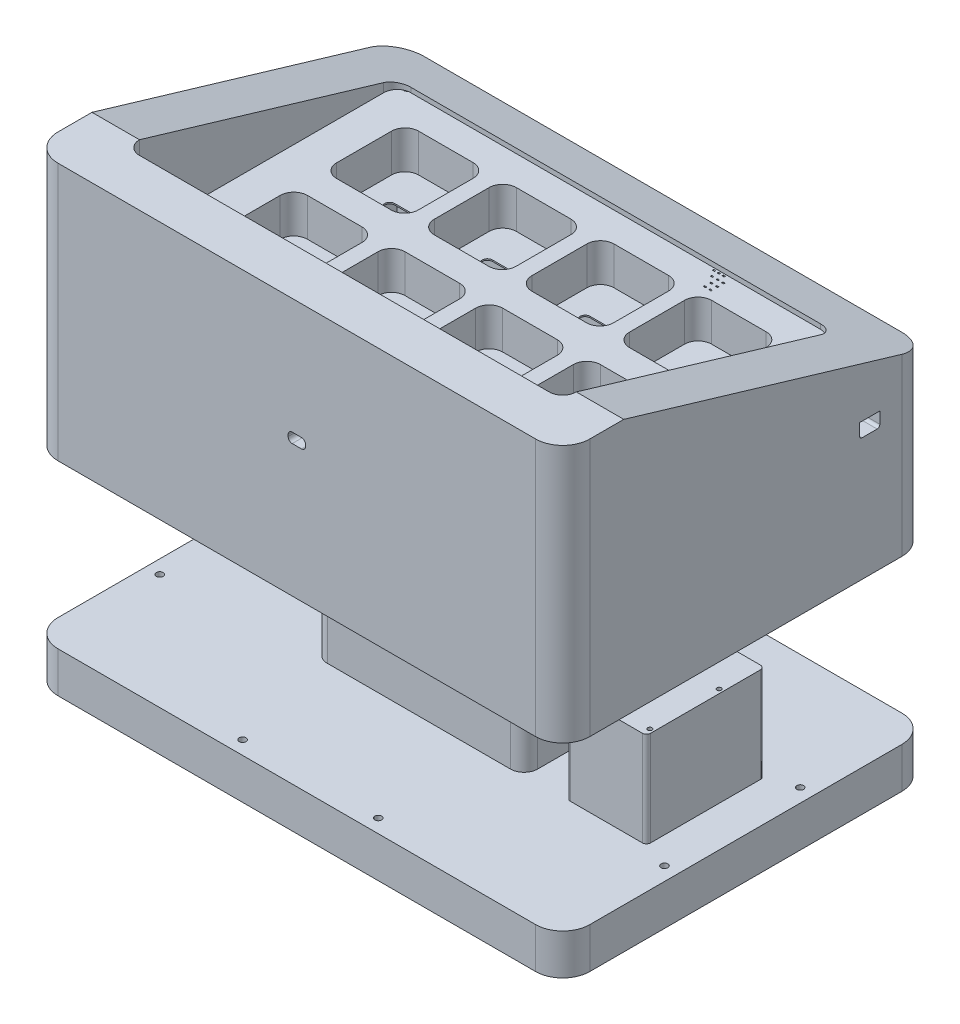
from build123d import *

# Parameters (mm, degrees)
BOSS_EXTRUDE1_DEPTH      = 30
SKETCH3_W                = 155
SKETCH3_H                = 90
BOSS_EXTRUDE2_DEPTH      = 70
SKETCH17_W               = 392
SKETCH17_H               = 270
BOSS_EXTRUDE3_DEPTH      = 190
FILLET4_R                = 20
FILLET5_R                = 10
CUT_EXTRUDE1_DEPTH       = 60
CUT_EXTRUDE2_DEPTH       = 28
CUT_EXTRUDE11_DEPTH      = 31
SKETCH101_W              = 352
SKETCH101_H              = 230
CUT_EXTRUDE12_DEPTH      = 101
SKETCH107_R              = 2.5
CUT_EXTRUDE14_DEPTH      = 30
FILLET6_R                = 20
SKETCH144_W              = 3.05
SKETCH144_H              = 6.1
CUT_EXTRUDE25_DEPTH      = 20
CUT_EXTRUDE27_DEPTH      = 370
CUT_EXTRUDE27_DEPTH_BACK = 35
BOSS_EXTRUDE12_START     = -30
BOSS_EXTRUDE12_DEPTH     = 30
CUT_EXTRUDE29_DEPTH      = 70
SKETCH173_W              = 15
SKETCH173_H              = 10
BOSS_EXTRUDE13_DEPTH     = 20
SKETCH174_W              = 15
SKETCH174_H              = 15
CUT_EXTRUDE37_DEPTH      = 20
FILLET8_R                = 2
BOSS_EXTRUDE24_DEPTH     = 20
SKETCH209_W              = 1.6
SKETCH209_H              = 1
CUT_EXTRUDE42_DEPTH      = 30
CUT_EXTRUDE43_DEPTH      = 20
CUT_EXTRUDE44_DEPTH      = 19.5
SKETCH229_R              = 2.25
CUT_EXTRUDE46_DEPTH      = 20
SKETCH230_R              = 1.6
BOSS_EXTRUDE27_DEPTH     = 70
SKETCH231_R              = 2.25
CUT_EXTRUDE47_DEPTH      = 20
SKETCH232_R              = 2.5
CUT_EXTRUDE48_DEPTH      = 30


with BuildPart() as part:
    # Sketch2 → Boss-Extrude1 (new body)
    with BuildSketch(Plane(origin=(0, 0, 0), x_dir=(1, 0, 0), z_dir=(0, 1, 0))):
        Polygon((-196, 135), (-196, -135), (-61, -135), (196, -135), (196, 135), align=None)
    extrude(amount=BOSS_EXTRUDE1_DEPTH)

    # Sketch3 → Boss-Extrude2 (add)
    with BuildSketch(Plane(origin=(0, 30, 0), x_dir=(1, 0, 0), z_dir=(0, 1, 0))):
        Rectangle(SKETCH3_W, SKETCH3_H)
    extrude(amount=BOSS_EXTRUDE2_DEPTH)

    # Fillet5
    fillet5_edges = [part.edges().sort_by_distance(p)[0] for p in [
        (77.5, 65, -45),
        (-77.5, 65, -45),
        (-77.5, 65, 45),
        (77.5, 65, 45),
    ]]
    fillet(fillet5_edges, radius=FILLET5_R)

    # Fillet6
    fillet6_edges = [part.edges().sort_by_distance(p)[0] for p in [
        (196, 15, 135),
        (-196, 15, 135),
        (-196, 15, -135),
        (196, 15, -135),
    ]]
    fillet(fillet6_edges, radius=FILLET6_R)

    # Sketch150 → Boss-Extrude12 (add)
    with BuildSketch(Plane.XZ.offset(BOSS_EXTRUDE12_START)):
        with BuildLine():
            Line((176, 135), (-176, 135))
            ThreePointArc((-176, 135), (-190.142135624, 129.142135624), (-196, 115))
            Line((-196, 115), (-196, -115))
            ThreePointArc((-196, -115), (-190.142135624, -129.142135624), (-176, -135))
            Line((-176, -135), (176, -135))
            ThreePointArc((176, -135), (190.142135624, -129.142135624), (196, -115))
            Line((196, -115), (196, 115))
            ThreePointArc((196, 115), (190.142135624, 129.142135624), (176, 135))
        make_face()
    extrude(amount=BOSS_EXTRUDE12_DEPTH)

    # Sketch151 → Cut-Extrude29 (cut)
    with BuildSketch(Plane(origin=(0, 100, 0), x_dir=(1, 0, 0), z_dir=(0, 1, 0))):
        with BuildLine():
            Line((-67.5, -38), (67.5, -38))
            ThreePointArc((67.5, -38), (69.621320344, -37.121320344), (70.5, -35))
            Line((70.5, -35), (70.5, 35))
            ThreePointArc((70.5, 35), (69.621320344, 37.121320344), (67.5, 38))
            Line((67.5, 38), (-67.5, 38))
            ThreePointArc((-67.5, 38), (-69.621320344, 37.121320344), (-70.5, 35))
            Line((-70.5, 35), (-70.5, -35))
            ThreePointArc((-70.5, -35), (-69.621320344, -37.121320344), (-67.5, -38))
        make_face()
    extrude(amount=-CUT_EXTRUDE29_DEPTH, mode=Mode.SUBTRACT)

    # Sketch230 → Boss-Extrude27 (add)
    with BuildSketch(Plane(origin=(0, 30, 0), x_dir=(1, 0, 0), z_dir=(0, 1, 0))):
        with BuildLine():
            Line((110.25, 43.5), (163.25, 43.5))
            ThreePointArc((163.25, 43.5), (165.371320344, 42.621320344), (166.25, 40.5))
            Line((166.25, 40.5), (166.25, -40.5))
            ThreePointArc((166.25, -40.5), (165.371320344, -42.621320344), (163.25, -43.5))
            Line((163.25, -43.5), (110.25, -43.5))
            ThreePointArc((110.25, -43.5), (108.128679656, -42.621320344), (107.25, -40.5))
            Line((107.25, -40.5), (107.25, 40.5))
            ThreePointArc((107.25, 40.5), (108.128679656, 42.621320344), (110.25, 43.5))
        make_face()
        with Locations(Location((163.25, -38, 0), (0, 0, 270))):
            Circle(SKETCH230_R, mode=Mode.SUBTRACT)
        with Locations(Location((163.25, 13, 0), (0, 0, 90))):
            Circle(SKETCH230_R, mode=Mode.SUBTRACT)
        with Locations(Location((116.25, -38, 0), (0, 0, 90))):
            Circle(SKETCH230_R, mode=Mode.SUBTRACT)
        with Locations(Location((116.25, 13, 0), (0, 0, 270))):
            Circle(SKETCH230_R, mode=Mode.SUBTRACT)
    extrude(amount=BOSS_EXTRUDE27_DEPTH)

    # Sketch232 → Cut-Extrude48 (cut)
    with BuildSketch(Plane(origin=(0, 30, 0), x_dir=(1, 0, 0), z_dir=(0, 1, 0))):
        with Locations(Location((-50, 125, 0), (0, 0, 270))):
            Circle(SKETCH232_R)
        with Locations(Location((50, 125, 0), (0, 0, 90))):
            Circle(SKETCH232_R)
        with Locations(Location((-186, 50, 0), (0, 0, 270))):
            Circle(SKETCH232_R)
        with Locations(Location((-186, -50, 0), (0, 0, 90))):
            Circle(SKETCH232_R)
    cut_extrude48 = extrude(amount=-CUT_EXTRUDE48_DEPTH, mode=Mode.SUBTRACT)

    # Mirror11: Cut-Extrude48 across plane
    add(cut_extrude48.mirror(Plane.XY), mode=Mode.SUBTRACT)

    # Mirror11 at the second plane: Cut-Extrude48 across plane
    add(cut_extrude48.mirror(Plane(origin=(0, 0, 0), x_dir=(0, 0, 1), z_dir=(1, 0, 0))), mode=Mode.SUBTRACT)


with BuildPart() as body_2:
    # Sketch17 → Boss-Extrude3 (new body)
    with BuildSketch(Plane(origin=(0, 150, 0), x_dir=(1, 0, 0), z_dir=(0, 1, 0))):
        Rectangle(SKETCH17_W, SKETCH17_H)
    extrude(amount=BOSS_EXTRUDE3_DEPTH)

    # Fillet4
    fillet4_edges = [body_2.edges().sort_by_distance(p)[0] for p in [
        (196, 245, 135),
        (-196, 245, 135),
        (-196, 245, -135),
        (196, 245, -135),
    ]]
    fillet(fillet4_edges, radius=FILLET4_R)

    # Sketch71 → Cut-Extrude1 (cut)
    with BuildSketch(Plane(origin=(0, 340, 0), x_dir=(1, 0, 0), z_dir=(0, 1, 0))):
        with BuildLine():
            Line((-161, 90), (-161, -90))
            ThreePointArc((-161, -90), (-158.071067812, -97.071067812), (-151, -100))
            Line((-151, -100), (151, -100))
            ThreePointArc((151, -100), (158.071067812, -97.071067812), (161, -90))
            Line((161, -90), (161, 90))
            ThreePointArc((161, 90), (158.071067812, 97.071067812), (151, 100))
            Line((151, 100), (-151, 100))
            ThreePointArc((-151, 100), (-158.071067812, 97.071067812), (-161, 90))
        make_face()
    extrude(amount=-CUT_EXTRUDE1_DEPTH, mode=Mode.SUBTRACT)

    # Sketch75 → Cut-Extrude2 (cut)
    with BuildSketch(Plane(origin=(0, 280, 0), x_dir=(1, 0, 0), z_dir=(0, 1, 0))):
        with BuildLine():
            Line((-73.4, -33.357), (-73.4, -13.627))
            ThreePointArc((-73.4, -13.627), (-76.328932188, -6.555932188), (-83.4, -3.627))
            Line((-83.4, -3.627), (-107, -3.627))
            Line((-107, -3.627), (-123.6, -3.627))
            ThreePointArc((-123.6, -3.627), (-130.671067812, -6.555932188), (-133.6, -13.627))
            Line((-133.6, -13.627), (-133.6, -33.357))
            Line((-133.6, -33.357), (-133.6, -54.087))
            ThreePointArc((-133.6, -54.087), (-130.671067812, -61.158067812), (-123.6, -64.087))
            Line((-123.6, -64.087), (-107, -64.087))
            Line((-107, -64.087), (-83.4, -64.087))
            ThreePointArc((-83.4, -64.087), (-76.328932188, -61.158067812), (-73.4, -54.087))
            Line((-73.4, -54.087), (-73.4, -33.357))
        make_face()
        with BuildLine():
            Line((-1.4, -54.087), (-1.4, -33.357))
            Line((-1.4, -33.357), (-1.4, -13.627))
            ThreePointArc((-1.4, -13.627), (-4.328932188, -6.555932188), (-11.4, -3.627))
            Line((-11.4, -3.627), (-35, -3.627))
            Line((-35, -3.627), (-51.6, -3.627))
            ThreePointArc((-51.6, -3.627), (-58.671067812, -6.555932188), (-61.6, -13.627))
            Line((-61.6, -13.627), (-61.6, -33.357))
            Line((-61.6, -33.357), (-61.6, -54.087))
            ThreePointArc((-61.6, -54.087), (-58.671067812, -61.158067812), (-51.6, -64.087))
            Line((-51.6, -64.087), (-35, -64.087))
            Line((-35, -64.087), (-11.4, -64.087))
            ThreePointArc((-11.4, -64.087), (-4.328932188, -61.158067812), (-1.4, -54.087))
        make_face()
        with BuildLine():
            Line((70.6, -54.087), (70.6, -33.357))
            Line((70.6, -33.357), (70.6, -13.627))
            ThreePointArc((70.6, -13.627), (67.671067812, -6.555932188), (60.6, -3.627))
            Line((60.6, -3.627), (37, -3.627))
            Line((37, -3.627), (20.4, -3.627))
            ThreePointArc((20.4, -3.627), (13.328932188, -6.555932188), (10.4, -13.627))
            Line((10.4, -13.627), (10.4, -33.357))
            Line((10.4, -33.357), (10.4, -54.087))
            ThreePointArc((10.4, -54.087), (13.328932188, -61.158067812), (20.4, -64.087))
            Line((20.4, -64.087), (37, -64.087))
            Line((37, -64.087), (60.6, -64.087))
            ThreePointArc((60.6, -64.087), (67.671067812, -61.158067812), (70.6, -54.087))
        make_face()
        with BuildLine():
            Line((142.6, -54.087), (142.6, -33.357))
            Line((142.6, -33.357), (142.6, -13.627))
            ThreePointArc((142.6, -13.627), (139.671067812, -6.555932188), (132.6, -3.627))
            Line((132.6, -3.627), (109, -3.627))
            Line((109, -3.627), (92.4, -3.627))
            ThreePointArc((92.4, -3.627), (85.328932188, -6.555932188), (82.4, -13.627))
            Line((82.4, -13.627), (82.4, -33.357))
            Line((82.4, -33.357), (82.4, -54.087))
            ThreePointArc((82.4, -54.087), (85.328932188, -61.158067812), (92.4, -64.087))
            Line((92.4, -64.087), (109, -64.087))
            Line((109, -64.087), (132.6, -64.087))
            ThreePointArc((132.6, -64.087), (139.671067812, -61.158067812), (142.6, -54.087))
        make_face()
        with BuildLine():
            Line((109, 78.373), (132.6, 78.373))
            ThreePointArc((132.6, 78.373), (139.671067812, 75.444067812), (142.6, 68.373))
            Line((142.6, 68.373), (142.6, 47.643))
            Line((142.6, 47.643), (142.6, 27.913))
            ThreePointArc((142.6, 27.913), (139.671067812, 20.841932188), (132.6, 17.913))
            Line((132.6, 17.913), (109, 17.913))
            Line((109, 17.913), (92.4, 17.913))
            ThreePointArc((92.4, 17.913), (85.328932188, 20.841932188), (82.4, 27.913))
            Line((82.4, 27.913), (82.4, 47.643))
            Line((82.4, 47.643), (82.4, 68.373))
            ThreePointArc((82.4, 68.373), (85.328932188, 75.444067812), (92.4, 78.373))
            Line((92.4, 78.373), (109, 78.373))
        make_face()
        with BuildLine():
            Line((37, 78.373), (60.6, 78.373))
            ThreePointArc((60.6, 78.373), (67.671067812, 75.444067812), (70.6, 68.373))
            Line((70.6, 68.373), (70.6, 47.643))
            Line((70.6, 47.643), (70.6, 27.913))
            ThreePointArc((70.6, 27.913), (67.671067812, 20.841932188), (60.6, 17.913))
            Line((60.6, 17.913), (37, 17.913))
            Line((37, 17.913), (20.4, 17.913))
            ThreePointArc((20.4, 17.913), (13.328932188, 20.841932188), (10.4, 27.913))
            Line((10.4, 27.913), (10.4, 47.643))
            Line((10.4, 47.643), (10.4, 68.373))
            ThreePointArc((10.4, 68.373), (13.328932188, 75.444067812), (20.4, 78.373))
            Line((20.4, 78.373), (37, 78.373))
        make_face()
        with BuildLine():
            Line((-35, 78.373), (-11.4, 78.373))
            ThreePointArc((-11.4, 78.373), (-4.328932188, 75.444067812), (-1.4, 68.373))
            Line((-1.4, 68.373), (-1.4, 47.643))
            Line((-1.4, 47.643), (-1.4, 27.913))
            ThreePointArc((-1.4, 27.913), (-4.328932188, 20.841932188), (-11.4, 17.913))
            Line((-11.4, 17.913), (-35, 17.913))
            Line((-35, 17.913), (-51.6, 17.913))
            ThreePointArc((-51.6, 17.913), (-58.671067812, 20.841932188), (-61.6, 27.913))
            Line((-61.6, 27.913), (-61.6, 47.643))
            Line((-61.6, 47.643), (-61.6, 68.373))
            ThreePointArc((-61.6, 68.373), (-58.671067812, 75.444067812), (-51.6, 78.373))
            Line((-51.6, 78.373), (-35, 78.373))
        make_face()
        with BuildLine():
            Line((-107, 78.373), (-83.4, 78.373))
            ThreePointArc((-83.4, 78.373), (-76.328932188, 75.444067812), (-73.4, 68.373))
            Line((-73.4, 68.373), (-73.4, 47.643))
            Line((-73.4, 47.643), (-73.4, 27.913))
            ThreePointArc((-73.4, 27.913), (-76.328932188, 20.841932188), (-83.4, 17.913))
            Line((-83.4, 17.913), (-107, 17.913))
            Line((-107, 17.913), (-123.6, 17.913))
            ThreePointArc((-123.6, 17.913), (-130.671067812, 20.841932188), (-133.6, 27.913))
            Line((-133.6, 27.913), (-133.6, 47.643))
            Line((-133.6, 47.643), (-133.6, 68.373))
            ThreePointArc((-133.6, 68.373), (-130.671067812, 75.444067812), (-123.6, 78.373))
            Line((-123.6, 78.373), (-107, 78.373))
        make_face()
    extrude(amount=-CUT_EXTRUDE2_DEPTH, mode=Mode.SUBTRACT)

    # Sketch73 → Cut-Extrude11 (cut)
    with BuildSketch(Plane(origin=(0, 280, 0), x_dir=(1, 0, 0), z_dir=(0, 1, 0))):
        with BuildLine():
            Line((-42.17, -29.627), (-27.83, -29.627))
            ThreePointArc((-27.83, -29.627), (-24.1, -33.357), (-27.83, -37.087))
            Line((-27.83, -37.087), (-42.17, -37.087))
            ThreePointArc((-42.17, -37.087), (-45.9, -33.357), (-42.17, -29.627))
        make_face()
        with BuildLine():
            Line((-114.17, -29.627), (-99.83, -29.627))
            ThreePointArc((-99.83, -29.627), (-96.1, -33.357), (-99.83, -37.087))
            Line((-99.83, -37.087), (-114.17, -37.087))
            ThreePointArc((-114.17, -37.087), (-117.9, -33.357), (-114.17, -29.627))
        make_face()
        with BuildLine():
            Line((29.83, -29.627), (44.17, -29.627))
            ThreePointArc((44.17, -29.627), (47.9, -33.357), (44.17, -37.087))
            Line((44.17, -37.087), (29.83, -37.087))
            ThreePointArc((29.83, -37.087), (26.1, -33.357), (29.83, -29.627))
        make_face()
        with BuildLine():
            Line((101.83, -29.627), (116.17, -29.627))
            ThreePointArc((116.17, -29.627), (119.9, -33.357), (116.17, -37.087))
            Line((116.17, -37.087), (101.83, -37.087))
            ThreePointArc((101.83, -37.087), (98.1, -33.357), (101.83, -29.627))
        make_face()
        with BuildLine():
            Line((101.83, 51.373), (116.17, 51.373))
            ThreePointArc((116.17, 51.373), (119.9, 47.643), (116.17, 43.913))
            Line((116.17, 43.913), (101.83, 43.913))
            ThreePointArc((101.83, 43.913), (98.1, 47.643), (101.83, 51.373))
        make_face()
        with BuildLine():
            Line((29.83, 51.373), (44.17, 51.373))
            ThreePointArc((44.17, 51.373), (47.9, 47.643), (44.17, 43.913))
            Line((44.17, 43.913), (29.83, 43.913))
            ThreePointArc((29.83, 43.913), (26.1, 47.643), (29.83, 51.373))
        make_face()
        with BuildLine():
            Line((-42.17, 51.373), (-27.83, 51.373))
            ThreePointArc((-27.83, 51.373), (-24.1, 47.643), (-27.83, 43.913))
            Line((-27.83, 43.913), (-42.17, 43.913))
            ThreePointArc((-42.17, 43.913), (-45.9, 47.643), (-42.17, 51.373))
        make_face()
        with BuildLine():
            Line((-114.17, 51.373), (-99.83, 51.373))
            ThreePointArc((-99.83, 51.373), (-96.1, 47.643), (-99.83, 43.913))
            Line((-99.83, 43.913), (-114.17, 43.913))
            ThreePointArc((-114.17, 43.913), (-117.9, 47.643), (-114.17, 51.373))
        make_face()
    extrude(amount=-CUT_EXTRUDE11_DEPTH, mode=Mode.SUBTRACT)

    # Sketch101 → Cut-Extrude12 (cut)
    with BuildSketch(Plane.XZ.offset(-150)):
        Rectangle(SKETCH101_W, SKETCH101_H)
    extrude(amount=-CUT_EXTRUDE12_DEPTH, mode=Mode.SUBTRACT)

    # Sketch107 → Cut-Extrude14 (cut)
    with BuildSketch(Plane(origin=(0, 280, 0), x_dir=(1, 0, 0), z_dir=(0, 1, 0))):
        with Locations(Location((154.452, 102.42, 0), (0, 0, 270))):
            Circle(SKETCH107_R)
        with Locations(Location((-154.92, 101.343209704, 0), (0, 0, 255.9914886))):
            Circle(SKETCH107_R)
        with Locations(Location((-154.92, -102.304, 0), (0, 0, 270))):
            Circle(SKETCH107_R)
        with Locations(Location((154.452, -101.796, 0), (0, 0, 127.467169623))):
            Circle(SKETCH107_R)
    extrude(amount=-CUT_EXTRUDE14_DEPTH, mode=Mode.SUBTRACT)

    # Sketch144 → Cut-Extrude25 (cut)
    with BuildSketch(Plane(origin=(196, 0, 0), x_dir=(0, 0, -1), z_dir=(1, 0, 0))):
        with Locations((91.261, 247.95)):
            Rectangle(SKETCH144_W, SKETCH144_H)
    extrude(amount=-CUT_EXTRUDE25_DEPTH, mode=Mode.SUBTRACT)

    # Sketch79 → Cut-Extrude27 (cut, two sides: drawn at the far end of the back side and taken through both)
    with BuildSketch(Plane(origin=(-161, 0, 0), x_dir=(0, 0, -1), z_dir=(1, 0, 0)).offset(-CUT_EXTRUDE27_DEPTH_BACK)):
        Polygon((90, 340), (-90, 340), (175.444708825, 261.072055976), (175.444708825, 340), align=None)
    extrude(amount=CUT_EXTRUDE27_DEPTH + CUT_EXTRUDE27_DEPTH_BACK, mode=Mode.SUBTRACT)

    # Sketch173 → Boss-Extrude13 (add)
    with BuildSketch(Plane(origin=(196, 0, 0), x_dir=(0, 0, -1), z_dir=(1, 0, 0))):
        Polygon((71.306476455, 247.95), (71.306476455, 270.424819404), (113.475840222, 270.424819404), (113.475840222, 232.015781069), (71.306476455, 232.015781069), align=None)
        with Locations((91.261, 247.95)):
            Rectangle(SKETCH173_W, SKETCH173_H, mode=Mode.SUBTRACT)
    extrude(amount=-BOSS_EXTRUDE13_DEPTH)

    # Sketch174 → Cut-Extrude37 (cut)
    with BuildSketch(Plane(origin=(196, 0, 0), x_dir=(0, 0, -1), z_dir=(1, 0, 0))):
        with Locations((91.261, 247.95)):
            Rectangle(SKETCH174_W, SKETCH174_H)
    extrude(amount=-CUT_EXTRUDE37_DEPTH, mode=Mode.SUBTRACT)

    # Fillet8
    fillet8_edges = [body_2.edges().sort_by_distance(p)[0] for p in [
        (186, 255.45, -98.761),
        (186, 240.45, -98.761),
        (186, 240.45, -83.761),
        (186, 255.45, -83.761),
    ]]
    fillet(fillet8_edges, radius=FILLET8_R)

    # Sketch202 → Boss-Extrude24 (add)
    with BuildSketch(Plane(origin=(176, 0, 0), x_dir=(0, 0, -1), z_dir=(1, 0, 0))):
        with BuildLine():
            Line((98.761, 251), (98.761, 253.45))
            ThreePointArc((98.761, 253.45), (98.175213562, 254.864213562), (96.761, 255.45))
            Line((96.761, 255.45), (85.761, 255.45))
            ThreePointArc((85.761, 255.45), (84.346786438, 254.864213562), (83.761, 253.45))
            Line((83.761, 253.45), (83.761, 251))
            Line((83.761, 251), (98.761, 251))
        make_face()
    extrude(amount=BOSS_EXTRUDE24_DEPTH)

    # Sketch209 → Cut-Extrude42 (cut)
    with BuildSketch(Plane.XZ.offset(-251)):
        with Locations((74.188, -98.356)):
            Rectangle(SKETCH209_W, SKETCH209_H)
        with Locations((77.744, -98.356)):
            Rectangle(SKETCH209_W, SKETCH209_H)
        with Locations((81.3, -98.356)):
            Rectangle(SKETCH209_W, SKETCH209_H)
        with Locations((77.236, -93.784)):
            Rectangle(SKETCH209_W, SKETCH209_H)
        with Locations((81.506, -93.784)):
            Rectangle(SKETCH209_W, SKETCH209_H)
        with Locations((85.666, -93.784)):
            Rectangle(SKETCH209_W, SKETCH209_H)
        with Locations((85.666, -89.212)):
            Rectangle(SKETCH209_W, SKETCH209_H)
        with Locations((85.364, -84.64)):
            Rectangle(SKETCH209_W, SKETCH209_H)
        with Locations((81.3, -89.212)):
            Rectangle(SKETCH209_W, SKETCH209_H)
        with Locations((81.3, -84.64)):
            Rectangle(SKETCH209_W, SKETCH209_H)
    extrude(amount=-CUT_EXTRUDE42_DEPTH, mode=Mode.SUBTRACT)

    # Sketch220 → Cut-Extrude43 (cut)
    with BuildSketch(Plane.XY.offset(135)):
        with BuildLine():
            Line((-3.4, 252.65), (3.4, 252.65))
            ThreePointArc((3.4, 252.65), (4.107106781, 252.357106781), (4.4, 251.65))
            Line((4.4, 251.65), (4.4, 250.35))
            ThreePointArc((4.4, 250.35), (4.107106781, 249.642893219), (3.4, 249.35))
            Line((3.4, 249.35), (-3.4, 249.35))
            ThreePointArc((-3.4, 249.35), (-4.107106781, 249.642893219), (-4.4, 250.35))
            Line((-4.4, 250.35), (-4.4, 251.65))
            ThreePointArc((-4.4, 251.65), (-4.107106781, 252.357106781), (-3.4, 252.65))
        make_face()
    extrude(amount=-CUT_EXTRUDE43_DEPTH, mode=Mode.SUBTRACT)

    # Sketch221 → Cut-Extrude44 (cut)
    with BuildSketch(Plane.XY.offset(135)):
        with BuildLine():
            Line((-6.4, 251.65), (-6.4, 250.35))
            ThreePointArc((-6.4, 250.35), (-5.521320344, 248.228679656), (-3.4, 247.35))
            Line((-3.4, 247.35), (3.4, 247.35))
            ThreePointArc((3.4, 247.35), (5.521320344, 248.228679656), (6.4, 250.35))
            Line((6.4, 250.35), (6.4, 251.65))
            ThreePointArc((6.4, 251.65), (5.521320344, 253.771320344), (3.4, 254.65))
            Line((3.4, 254.65), (-3.4, 254.65))
            ThreePointArc((-3.4, 254.65), (-5.521320344, 253.771320344), (-6.4, 251.65))
        make_face()
        with BuildLine():
            Line((-3.4, 252.65), (3.4, 252.65))
            ThreePointArc((3.4, 252.65), (4.107106781, 252.357106781), (4.4, 251.65))
            Line((4.4, 251.65), (4.4, 250.35))
            ThreePointArc((4.4, 250.35), (4.107106781, 249.642893219), (3.4, 249.35))
            Line((3.4, 249.35), (-3.4, 249.35))
            ThreePointArc((-3.4, 249.35), (-4.107106781, 249.642893219), (-4.4, 250.35))
            Line((-4.4, 250.35), (-4.4, 251.65))
            ThreePointArc((-4.4, 251.65), (-4.107106781, 252.357106781), (-3.4, 252.65))
        make_face(mode=Mode.SUBTRACT)
    extrude(amount=-CUT_EXTRUDE44_DEPTH, mode=Mode.SUBTRACT)

    # Sketch229 → Cut-Extrude46 (cut)
    with BuildSketch(Plane.XZ.offset(-150)):
        with Locations(Location((-186, 50, 0), (0, 0, 270))):
            Circle(SKETCH229_R)
        with Locations(Location((-186, -50, 0), (0, 0, 270))):
            Circle(SKETCH229_R)
    cut_extrude46 = extrude(amount=-CUT_EXTRUDE46_DEPTH, mode=Mode.SUBTRACT)

    # Mirror9: Cut-Extrude46 across plane
    add(cut_extrude46.mirror(Plane(origin=(0, 0, 0), x_dir=(0, 0, 1), z_dir=(1, 0, 0))), mode=Mode.SUBTRACT)

    # Sketch231 → Cut-Extrude47 (cut)
    with BuildSketch(Plane.XZ.offset(-150)):
        with Locations(Location((-50, 125, 0), (0, 0, 270))):
            Circle(SKETCH231_R)
        with Locations(Location((50, 125, 0), (0, 0, 90))):
            Circle(SKETCH231_R)
    cut_extrude47 = extrude(amount=-CUT_EXTRUDE47_DEPTH, mode=Mode.SUBTRACT)

    # Mirror10: Cut-Extrude47 across plane
    add(cut_extrude47.mirror(Plane.XY), mode=Mode.SUBTRACT)


solid = Compound([part.part, body_2.part])
